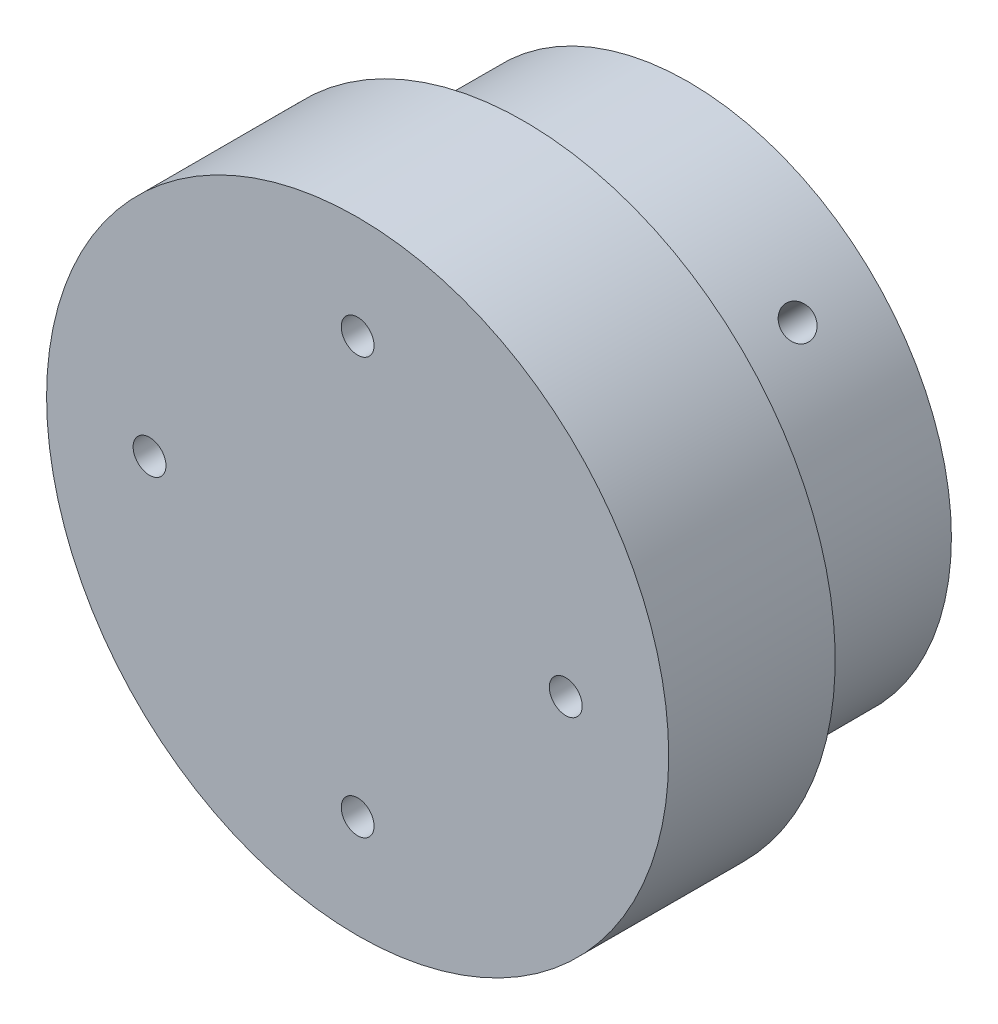
from build123d import *

# Parameters (mm, degrees)
SKETCH_1_R               = 37.5
EXTRUDE_1_DEPTH          = 15.5
SKETCH_2_R               = 3
CUT_EXTRUDE_1_DEPTH      = 16
SKETCH_4_R               = 4.8
CUT_EXTRUDE_2_DEPTH      = 4.5
SKETCH_6_R               = 24.01
EXTRUDE_2_DEPTH          = 23
SKETCH_7_R               = 28.4
EXTRUDE_3_DEPTH          = 14.2
SKETCH_5_R               = 1.5
CUT_EXTRUDE_3_DEPTH      = 33
SKETCH_9_R               = 2.75
CUT_EXTRUDE_6_DEPTH      = 58
EXTRUDE_START            = -1
SKETCH_10_R              = 28.4
EXTRUDE_5_DEPTH          = 1
SKETCH_11_R              = 4
CUT_EXTRUDE_7_DEPTH      = 22
CUT_EXTRUDE_9_DEPTH      = 74
CUT_EXTRUDE_9_DEPTH_BACK = 74
SKETCH_15_R              = 1.45
CUT_EXTRUDE_10_DEPTH     = 74
SKETCH_16_R              = 1.45
CUT_EXTRUDE_11_DEPTH     = 74


with BuildPart() as part:
    # 草图1 → 凸台-拉伸1 (new body)
    with BuildSketch(Plane.XY):
        Circle(SKETCH_1_R)
    extrude(amount=EXTRUDE_1_DEPTH)

    # 草图2 → 切除-拉伸1 (cut)
    with BuildSketch(Plane(origin=(0, 0, 0), x_dir=(-1, 0, 0), z_dir=(0, 0, -1))):
        with Locations((-25, 0)):
            Circle(SKETCH_2_R)
        with Locations((25, 0)):
            Circle(SKETCH_2_R)
        with Locations((0, 25)):
            Circle(SKETCH_2_R)
        with Locations((0, -25)):
            Circle(SKETCH_2_R)
    extrude(amount=-CUT_EXTRUDE_1_DEPTH, mode=Mode.SUBTRACT)

    # 草图4 → 切除-拉伸2 (cut)
    with BuildSketch(Plane.XY.offset(15.5)):
        with Locations((-25, 0)):
            Circle(SKETCH_4_R)
        with Locations((25, 0)):
            Circle(SKETCH_4_R)
        with Locations((0, 25)):
            Circle(SKETCH_4_R)
        with Locations((0, -25)):
            Circle(SKETCH_4_R)
    extrude(amount=-CUT_EXTRUDE_2_DEPTH, mode=Mode.SUBTRACT)

    # 草图6 → 凸台-拉伸2 (add)
    with BuildSketch(Plane.XY.offset(15.5)):
        Circle(SKETCH_6_R)
    extrude(amount=EXTRUDE_2_DEPTH)

    # 草图7 → 凸台-拉伸3 (add)
    with BuildSketch(Plane.XY.offset(38.5)):
        Circle(SKETCH_7_R)
    extrude(amount=EXTRUDE_3_DEPTH)

    # 草图5 → 切除-拉伸3 (cut)
    with BuildSketch(Plane.XY.offset(52.7)):
        with Locations((-19, 0)):
            Circle(SKETCH_5_R)
        with Locations((19, 0)):
            Circle(SKETCH_5_R)
        with Locations((0, 19)):
            Circle(SKETCH_5_R)
        with Locations((0, -19)):
            Circle(SKETCH_5_R)
    extrude(amount=-CUT_EXTRUDE_3_DEPTH, mode=Mode.SUBTRACT)

    # 草图9 → 切除-拉伸6 (cut)
    with BuildSketch(Plane(origin=(0, 0, 37.5), x_dir=(-1, 0, 0), z_dir=(0, 0, -1))):
        with Locations((-19, 0)):
            Circle(SKETCH_9_R)
        with Locations((0, 19)):
            Circle(SKETCH_9_R)
        with Locations((19, 0)):
            Circle(SKETCH_9_R)
        with Locations((0, -19)):
            Circle(SKETCH_9_R)
    extrude(amount=CUT_EXTRUDE_6_DEPTH, mode=Mode.SUBTRACT)

    # 草图10 → 凸台-拉伸5 (add)
    with BuildSketch(Plane(origin=(0, 0, 37.5), x_dir=(-1, 0, 0), z_dir=(0, 0, -1)).offset(EXTRUDE_START)):
        Circle(SKETCH_10_R)
        with BuildLine():
            ThreePointArc((-0.927741091, -20.178684211), (0, -20.5), (0.927741091, -20.178684211))
            ThreePointArc((0.927741091, -20.178684211), (14.28355698, -14.28355698), (20.178684211, -0.927741091))
            ThreePointArc((20.178684211, -0.927741091), (20.5, 0), (20.178684211, 0.927741091))
            ThreePointArc((20.178684211, 0.927741091), (14.28355698, 14.28355698), (0.927741091, 20.178684211))
            ThreePointArc((0.927741091, 20.178684211), (0, 20.5), (-0.927741091, 20.178684211))
            ThreePointArc((-0.927741091, 20.178684211), (-14.28355698, 14.28355698), (-20.178684211, 0.927741091))
            ThreePointArc((-20.178684211, 0.927741091), (-20.5, 0), (-20.178684211, -0.927741091))
            ThreePointArc((-20.178684211, -0.927741091), (-14.28355698, -14.28355698), (-0.927741091, -20.178684211))
        make_face(mode=Mode.SUBTRACT)
    extrude(amount=EXTRUDE_5_DEPTH)

    # 草图11 → 切除-拉伸7 (cut)
    with BuildSketch(Plane(origin=(0, 0, 37.5), x_dir=(-1, 0, 0), z_dir=(0, 0, -1))):
        with Locations((0, 19)):
            Circle(SKETCH_11_R)
        with Locations((-19, 0)):
            Circle(SKETCH_11_R)
        with Locations((19, 0)):
            Circle(SKETCH_11_R)
        with Locations((0, -19)):
            Circle(SKETCH_11_R)
    extrude(amount=CUT_EXTRUDE_7_DEPTH, mode=Mode.SUBTRACT)

    # 草图13 → 切除-拉伸9 (cut, two sides: drawn at the far end of the back side and taken through both)
    with BuildSketch(Plane(origin=(0, 0, 0), x_dir=(1, 0, 0), z_dir=(0, 1, 0)).offset(-CUT_EXTRUDE_9_DEPTH_BACK)):
        Polygon((-52.212490612, -22.5), (-52.212490612, 12.620192268), (47.798391164, 12.620192268), (47.798391164, -22.5), (0, -22.5), align=None)
    extrude(amount=CUT_EXTRUDE_9_DEPTH + CUT_EXTRUDE_9_DEPTH_BACK, mode=Mode.SUBTRACT)

    # 草图15 → 切除-拉伸10 (cut)
    with BuildSketch(Plane(origin=(16.977633816, -16.977633816, 0), x_dir=(0.7071067811865477, 0.7071067811865475, 0), z_dir=(-0.7071067811865475, 0.7071067811865477, 0))):
        with Locations((0, -29.5)):
            Circle(SKETCH_15_R)
    extrude(amount=CUT_EXTRUDE_10_DEPTH, mode=Mode.SUBTRACT)

    # 草图16 → 切除-拉伸11 (cut)
    with BuildSketch(Plane(origin=(-16.977633816, -16.977633816, 0), x_dir=(0, 0, 1), z_dir=(-0.7071067811865476, -0.7071067811865476, 0))):
        with Locations((29.5, 0)):
            Circle(SKETCH_16_R)
    extrude(amount=-CUT_EXTRUDE_11_DEPTH, mode=Mode.SUBTRACT)


solid = part.part
